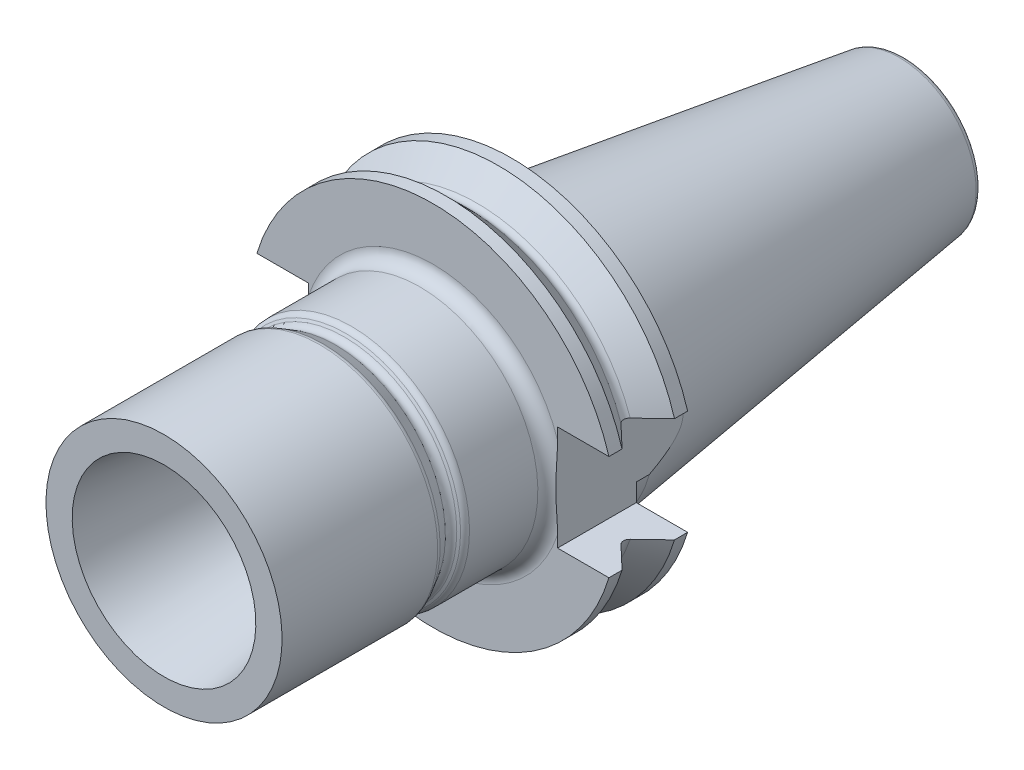
from build123d import *

# Parameters (mm, degrees)
M6_TAPPED_HOLE1_D     = 5
M6_TAPPED_HOLE1_DEPTH = 13.497848452
M6_TAPPED_HOLE1_TIP   = 1.502151548
SKETCH5_W             = 25.813357522
SKETCH5_H             = 8
CUT_EXTRUDE1_DEPTH    = 41.598645298


with BuildPart() as part:
    # Sketch1 → Revolve1 (revolve)
    with BuildSketch(Plane(origin=(0, 0, 0), x_dir=(0, 0, -1), z_dir=(1, 0, 0))):
        with BuildLine():
            Line((0, 10), (0, 14))
            Line((0, 14), (-1, 14))
            Line((-1, 14), (-2.646446609, 12.353553391))
            ThreePointArc((-2.646446609, 12.353553391), (-3, 12.207106781), (-3.353553391, 12.353553391))
            Line((-3.353553391, 12.353553391), (-5, 14))
            Line((-5, 14), (-6, 14))
            Line((-6, 14), (-6, 10))
            ThreePointArc((-6, 10), (-6.292893219, 9.292893219), (-7, 9))
            Line((-7, 9), (-12.211324865, 9))
            ThreePointArc((-12.211324865, 9), (-12.461324865, 8.933012702), (-12.644337567, 8.75))
            Line((-12.644337567, 8.75), (-12.75, 8.566987298))
            ThreePointArc((-12.75, 8.566987298), (-13.053603179, 8.334024385), (-13.433012702, 8.383974596))
            Line((-13.433012702, 8.383974596), (-14.383974596, 8.933012702))
            ThreePointArc((-14.383974596, 8.933012702), (-14.504565074, 8.982962913), (-14.633974596, 9))
            Line((-14.633974596, 9), (-26.5, 9))
            Line((-26.5, 9), (-26.5, 7))
            Line((-26.5, 7), (-15.826945416, 5.5))
            Line((-15.826945416, 5.5), (3.5, 5.5))
            Line((3.5, 5.5), (7.707106781, 1.292893219))
            ThreePointArc((7.707106781, 1.292893219), (7.923879533, 0.96846987), (8, 0.585786438))
            Line((8, 0.585786438), (8, 0))
            Line((8, 0), (9, 0))
            Line((9, 0), (28.5, 0))
            Line((28.5, 0), (28.5, 4))
            Line((28.5, 4), (30, 4))
            Line((30, 4), (30, 5.34913159))
            ThreePointArc((30, 5.34913159), (29.87735479, 5.677161105), (29.56958655, 5.844265624))
            Line((29.56958655, 5.844265624), (1, 9.859459165))
            Line((1, 9.859459165), (0, 9.859459165))
            Line((0, 9.859459165), (0, 10))
        make_face()
    revolve(axis=Axis((0, 0, -28.5), (0, 0, 1)))

    # M6 Tapped Hole1
    with Locations(Plane(origin=(0, 0, -28.5), x_dir=(-1, 0, 0), z_dir=(0, 0, -1))):
        with Locations((0, 0)):
            Hole(M6_TAPPED_HOLE1_D / 2, depth=M6_TAPPED_HOLE1_DEPTH)
            with Locations((0, 0, -(M6_TAPPED_HOLE1_DEPTH + M6_TAPPED_HOLE1_TIP / 2))):  # 118° drill point
                Cone(0, M6_TAPPED_HOLE1_D / 2, M6_TAPPED_HOLE1_TIP, mode=Mode.SUBTRACT)

    # Sketch5 → Cut-Extrude1 (cut, through all)
    with BuildSketch(Plane(origin=(9.5, 0, 0), x_dir=(0, 0, -1), z_dir=(1, 0, 0))):
        with Locations((-2.646446609, 0)):
            Rectangle(SKETCH5_W, SKETCH5_H)
    cut_extrude1 = extrude(amount=CUT_EXTRUDE1_DEPTH, mode=Mode.SUBTRACT)

    # Mirror1: Cut-Extrude1 across plane
    add(cut_extrude1.mirror(Plane(origin=(0, 0, 0), x_dir=(0, 0, 1), z_dir=(1, 0, 0))), mode=Mode.SUBTRACT)


solid = part.part
